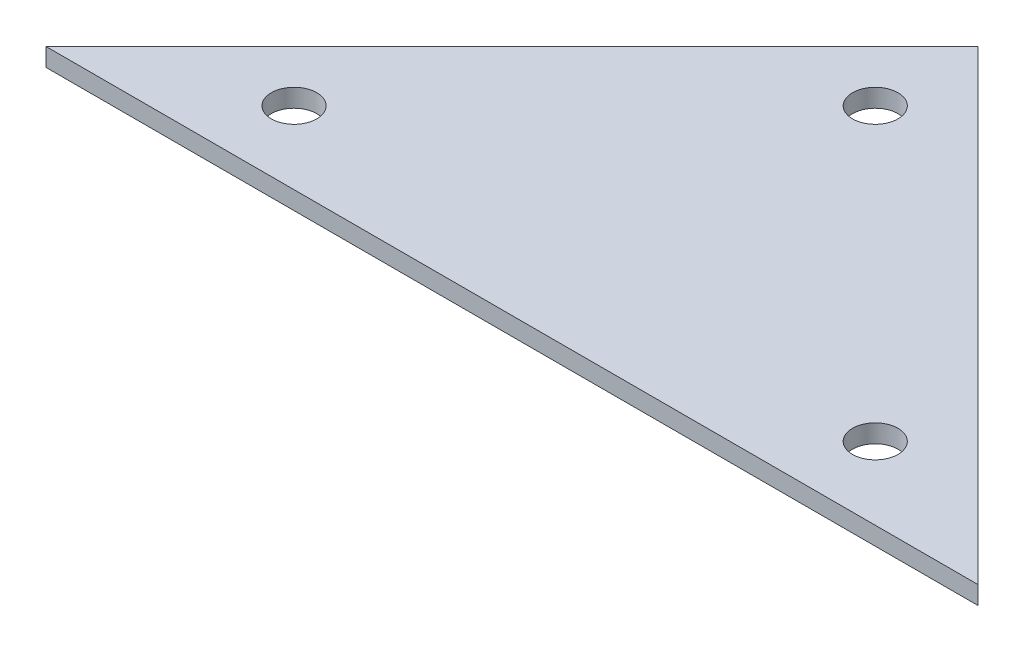
from build123d import *

# Parameters (mm, degrees)
SKETCH1_R           = 3.96875
BOSS_EXTRUDE1_DEPTH = 1.5875


with BuildPart() as part:
    # Sketch1 → Boss-Extrude1 (new, symmetric)
    with BuildSketch(Plane(origin=(0, 0, 0), x_dir=(1, 0, 0), z_dir=(0, 1, 0))):
        Polygon((0, 68.760512242), (-81.460512242, -12.7), (81.460512242, -12.7), align=None)
        with Locations(Location((-50.8, 0, 0), (0, 0, 270))):
            Circle(SKETCH1_R, mode=Mode.SUBTRACT)
        with Locations(Location((0, 50.8, 0), (0, 0, 270))):
            Circle(SKETCH1_R, mode=Mode.SUBTRACT)
        with Locations(Location((50.8, 0, 0), (0, 0, 270))):
            Circle(SKETCH1_R, mode=Mode.SUBTRACT)
    extrude(amount=BOSS_EXTRUDE1_DEPTH, both=True)


solid = part.part
